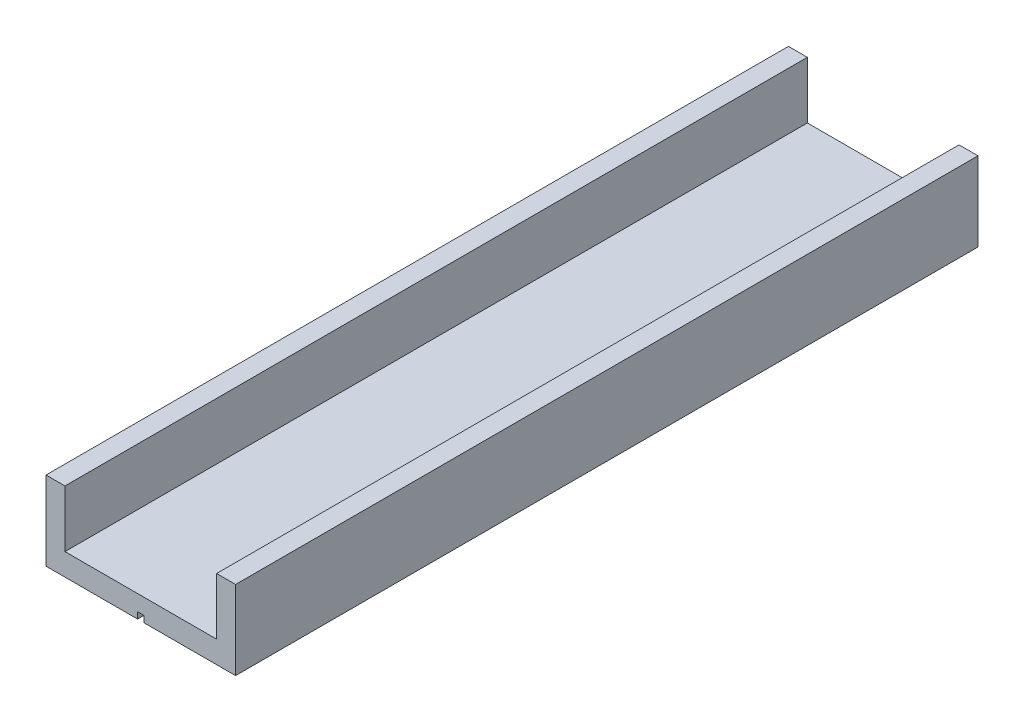
from build123d import *

# Parameters (mm, degrees)
EXTRUDE_1_DEPTH = 235


with BuildPart() as part:
    # 草图1 → 凸台-拉伸1 (new body)
    with BuildSketch(Plane.XY):
        Polygon((0, 0), (29, 0), (29, 2), (31, 2), (31, 0), (60, 0), (60, 25), (54, 25), (54, 7), (6, 7), (6, 25), (0, 25), align=None)
    extrude(amount=EXTRUDE_1_DEPTH)


solid = part.part
